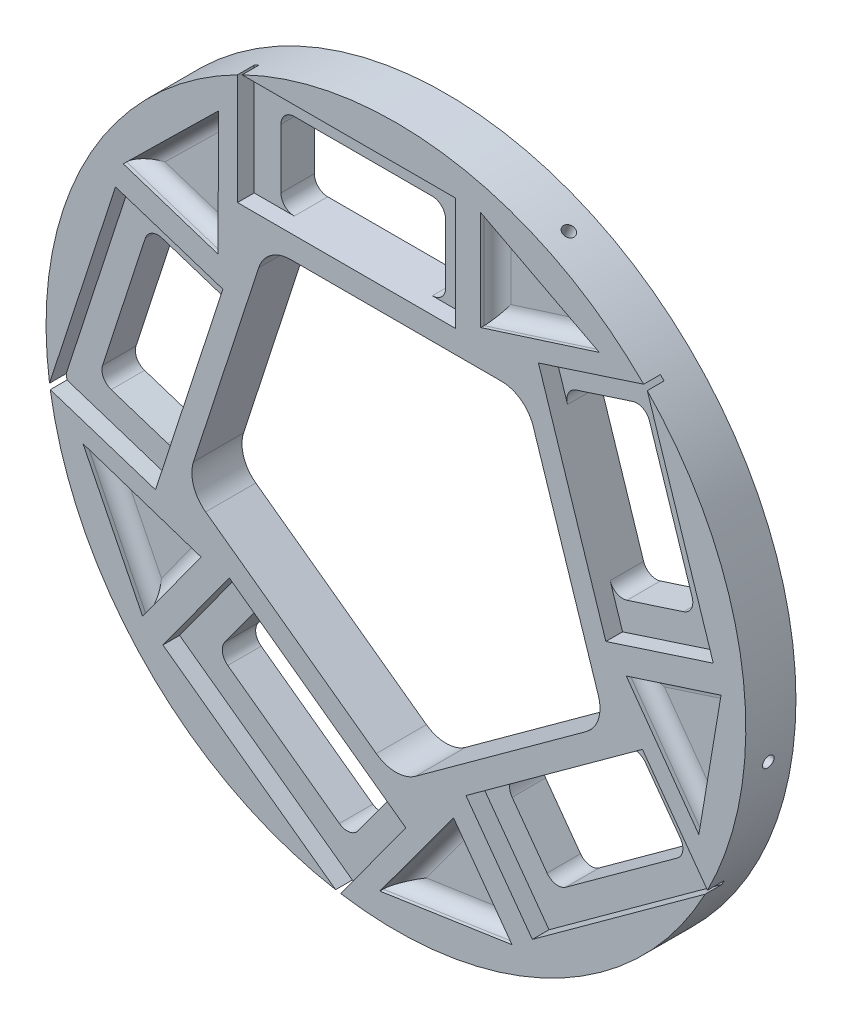
from build123d import *

# Parameters (mm, degrees)
SKETCH1_R                = 66.4845
BOSS_EXTRUDE1_DEPTH      = 9.525
CUT_EXTRUDE1_DEPTH       = 95.504513678
FILLET1_R                = 6.35
SKETCH3_W                = 41.453999896
SKETCH3_H                = 21.463
CUT_EXTRUDE5_DEPTH       = 3.175
SKETCH4_W                = 31.293999896
SKETCH4_H                = 16.383
CUT_EXTRUDE6_DEPTH       = 95.237465907
FILLET2_R                = 2.54
CIRPATTERN1_COUNT        = 5
FILLET2_OF_CIRPATTERN1_R = 2.54


with BuildPart() as part:
    # Sketch1 → Boss-Extrude1 (new body)
    with BuildSketch(Plane.XY):
        with Locations(Location((0, 0, 0), (0, 0, 180))):
            Circle(SKETCH1_R)
    extrude(amount=BOSS_EXTRUDE1_DEPTH)

    # Sketch2 → Cut-Extrude1 (cut, through all)
    with BuildSketch(Plane.XY.offset(9.525)):
        Polygon((24.653254911, 33.93229434), (-24.653254911, 33.93229434), (-39.889804379, -12.960983122), (0, -41.942622437), (39.889804379, -12.960983122), align=None)
    extrude(amount=-CUT_EXTRUDE1_DEPTH, mode=Mode.SUBTRACT)

    # Fillet1
    fillet1_edges = [part.edges().sort_by_distance(p)[0] for p in [
        (24.653254911, 33.93229434, 4.7625),
        (39.889804379, -12.960983122, 4.7625),
        (0, -41.942622437, 4.7625),
        (-39.889804379, -12.960983122, 4.7625),
        (-24.653254911, 33.93229434, 4.7625),
    ]]
    fillet(fillet1_edges, radius=FILLET1_R)

    # Sketch3 → Cut-Extrude5 (cut)
    with BuildSketch(Plane.XY.offset(9.525)):
        Polygon((16.110904278, 40.793694229), (16.110904278, 59.716694229), (38.633115128, 47.973184599), align=None)
        with Locations((-9.37859567, 48.985194229)):
            Rectangle(SKETCH3_W, SKETCH3_H)
    cut_extrude5 = extrude(amount=-CUT_EXTRUDE5_DEPTH, mode=Mode.SUBTRACT)

    # Sketch4 → Cut-Extrude6 (cut, through all)
    with BuildSketch(Plane.XY.offset(6.35)):
        with Locations((-9.37859567, 46.445194229)):
            Rectangle(SKETCH4_W, SKETCH4_H)
    cut_extrude6 = extrude(amount=-CUT_EXTRUDE6_DEPTH, mode=Mode.SUBTRACT)

    # Fillet2
    fillet2_edges = [part.edges().sort_by_distance(p)[0] for p in [
        (27.372009703, 44.383439414, 6.35),
        (16.110904278, 50.255194229, 6.35),
        (27.372009703, 53.844939414, 6.35),
        (-25.025595618, 38.253694229, 3.175),
        (-25.025595618, 54.636694229, 3.175),
        (6.268404278, 54.636694229, 3.175),
        (6.268404278, 38.253694229, 3.175),
    ]]
    fillet(fillet2_edges, radius=FILLET2_R)

    # Sketch7 → #44 (0.086) Diameter Hole1 (revolve, cut)
    with BuildSketch(Plane(origin=(28.097563823, 60.255420067, 4.7625), x_dir=(-0.9063077870366496, 0.4226182617407002, 0), z_dir=(0, 0, 1))):
        Polygon((0, 0), (0, 14.626259968), (1.0922, 13.97), (1.0922, 0), align=None)
    f_44_0_086_diameter_hole1 = revolve(axis=Axis((30.781189785, 66.010474515, 4.7625), (-0.42261826174070033, -0.9063077870366496, 0)), mode=Mode.SUBTRACT)

    # CirPattern1: Cut-Extrude5, Cut-Extrude6, #44 (0.086) Diameter Hole1 ×5 about axis
    cirpattern1_axis = Axis((0, 0, 0), (0, 0, 1))
    add([cut_extrude5.rotate(cirpattern1_axis, i * 360 / CIRPATTERN1_COUNT) for i in range(1, CIRPATTERN1_COUNT)], mode=Mode.SUBTRACT)
    add([cut_extrude6.rotate(cirpattern1_axis, i * 360 / CIRPATTERN1_COUNT) for i in range(1, CIRPATTERN1_COUNT)], mode=Mode.SUBTRACT)
    add([f_44_0_086_diameter_hole1.rotate(cirpattern1_axis, i * 360 / CIRPATTERN1_COUNT) for i in range(1, CIRPATTERN1_COUNT)], mode=Mode.SUBTRACT)

    # Fillet2 of CirPattern1
    fillet2_of_cirpattern1_edges = [part.edges().sort_by_distance(p)[0] for p in [
        (-33.752743102, 39.74756524, 6.35),
        (-42.816986733, 30.852089569, 6.35),
        (-42.751164331, 42.671329532, 6.35),
        (-44.114759509, -11.979714172, 3.175),
        (-59.695918416, -6.917088753, 3.175),
        (-50.025540626, 22.845273769, 3.175),
        (-34.44438172, 17.78264835, 3.175),
        (-48.232352153, -19.818093126, 6.35),
        (-42.573257375, -31.187554251, 6.35),
        (-53.793682318, -27.472607418, 6.35),
        (-2.238825164, -45.657564763, 3.175),
        (-11.868510953, -58.911690182, 3.175),
        (-37.18588869, -40.517538558, 3.175),
        (-27.556202902, -27.263413139, 3.175),
        (3.943510114, -51.995820384, 6.35),
        (16.505266663, -50.127058123, 6.35),
        (9.504840278, -59.650334676, 6.35),
        (42.731089463, -16.238212695, 3.175),
        (52.360775251, -29.492338114, 3.175),
        (27.043397513, -47.886489738, 3.175),
        (17.413711725, -34.632364319, 3.175),
        (50.669575439, -12.317091144, 6.35),
        (52.774073166, 0.207328575, 6.35),
        (59.667996668, -9.393326852, 6.35),
        (28.648090829, 35.621797401, 3.175),
        (44.229249735, 40.68442282, 3.175),
        (53.899627525, 10.922060298, 3.175),
        (38.318468619, 5.859434879, 3.175),
    ]]
    fillet(fillet2_of_cirpattern1_edges, radius=FILLET2_OF_CIRPATTERN1_R)


solid = part.part
